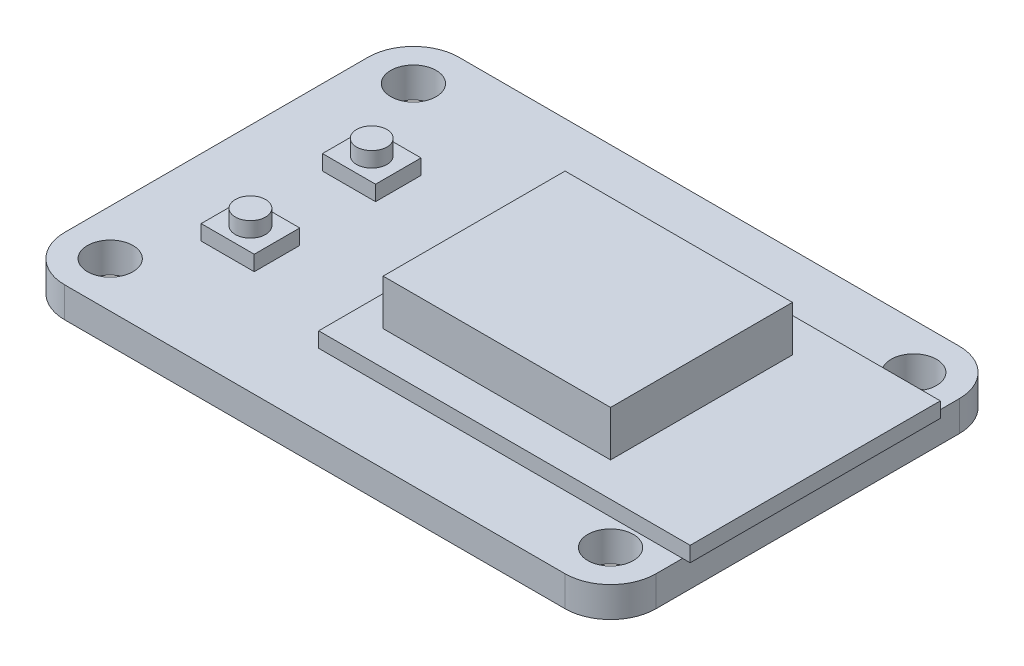
from build123d import *

# Parameters (mm, degrees)
SKETCH1_W           = 39
SKETCH1_H           = 26
BOSS_EXTRUDE1_DEPTH = 2
SKETCH2_R           = 1.5
CUT_EXTRUDE1_DEPTH  = 24.521266973
SKETCH3_W           = 24.5
SKETCH3_H           = 16.5
BOSS_EXTRUDE2_DEPTH = 1
SKETCH4_W           = 15
SKETCH4_H           = 12
BOSS_EXTRUDE3_DEPTH = 3
SKETCH5_W           = 3.5
SKETCH5_H           = 3
BOSS_EXTRUDE4_DEPTH = 1
SKETCH6_R           = 1
BOSS_EXTRUDE5_DEPTH = 1
FILLET1_R           = 3


with BuildPart() as part:
    # Sketch1 → Boss-Extrude1 (new body)
    with BuildSketch(Plane(origin=(0, 0, 0), x_dir=(1, 0, 0), z_dir=(0, 1, 0))):
        Rectangle(SKETCH1_W, SKETCH1_H)
    extrude(amount=BOSS_EXTRUDE1_DEPTH)

    # Sketch2 → Cut-Extrude1 (cut, through all)
    with BuildSketch(Plane(origin=(0, 2, 0), x_dir=(1, 0, 0), z_dir=(0, 1, 0))):
        with Locations(Location((-16.5, 10, 0), (0, 0, 270))):
            Circle(SKETCH2_R)
        with Locations(Location((-16.5, -10, 0), (0, 0, 270))):
            Circle(SKETCH2_R)
        with Locations(Location((16.5, -10, 0), (0, 0, 270))):
            Circle(SKETCH2_R)
        with Locations(Location((16.5, 10, 0), (0, 0, 270))):
            Circle(SKETCH2_R)
    extrude(amount=-CUT_EXTRUDE1_DEPTH, mode=Mode.SUBTRACT)

    # Sketch3 → Boss-Extrude2 (add)
    with BuildSketch(Plane(origin=(0, 2, 0), x_dir=(1, 0, 0), z_dir=(0, 1, 0))):
        with Locations((7.75, 0)):
            Rectangle(SKETCH3_W, SKETCH3_H)
    extrude(amount=BOSS_EXTRUDE2_DEPTH)

    # Sketch4 → Boss-Extrude3 (add)
    with BuildSketch(Plane(origin=(0, 3, 0), x_dir=(1, 0, 0), z_dir=(0, 1, 0))):
        with Locations((5, 0)):
            Rectangle(SKETCH4_W, SKETCH4_H)
    extrude(amount=BOSS_EXTRUDE3_DEPTH)

    # Sketch5 → Boss-Extrude4 (add)
    with BuildSketch(Plane(origin=(0, 2, 0), x_dir=(1, 0, 0), z_dir=(0, 1, 0))):
        with Locations((-12.75, 3.5)):
            Rectangle(SKETCH5_W, SKETCH5_H)
        with Locations((-12.75, -4.5)):
            Rectangle(SKETCH5_W, SKETCH5_H)
    extrude(amount=BOSS_EXTRUDE4_DEPTH)

    # Sketch6 → Boss-Extrude5 (add)
    with BuildSketch(Plane(origin=(0, 3, 0), x_dir=(1, 0, 0), z_dir=(0, 1, 0))):
        with Locations(Location((-12.75, 3.5, 0), (0, 0, 270))):
            Circle(SKETCH6_R)
        with Locations(Location((-12.75, -4.5, 0), (0, 0, 270))):
            Circle(SKETCH6_R)
    extrude(amount=BOSS_EXTRUDE5_DEPTH)

    # Fillet1
    fillet1_edges = [part.edges().sort_by_distance(p)[0] for p in [
        (19.5, 1, 13),
        (-19.5, 1, 13),
        (-19.5, 1, -13),
        (19.5, 1, -13),
    ]]
    fillet(fillet1_edges, radius=FILLET1_R)


solid = part.part
